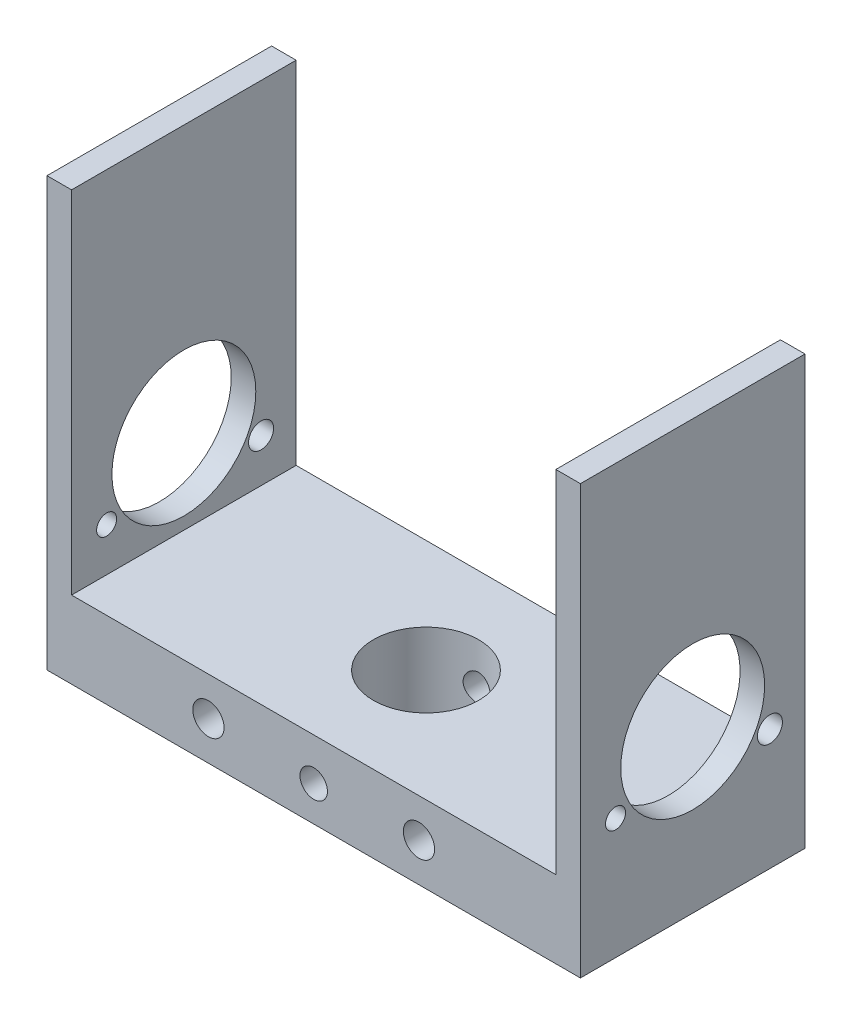
from build123d import *

# Parameters (mm, degrees)
BOSS_EXTRUDE1_DEPTH = 11
SKETCH2_W           = 3.5
SKETCH2_H           = 32
BOSS_EXTRUDE2_DEPTH = 50
SKETCH3_R           = 10.25
SKETCH3_R_2         = 1.783609491
SKETCH3_R_3         = 1.426196869
CUT_EXTRUDE1_DEPTH  = 50
SKETCH4_R           = 2.22645949
CUT_EXTRUDE2_DEPTH  = 36
SKETCH5_R           = 1.95657882
CUT_EXTRUDE3_DEPTH  = 32


with BuildPart() as part:
    # Sketch1 → Boss-Extrude1 (new body)
    with BuildSketch(Plane(origin=(0, 0, 0), x_dir=(1, 0, 0), z_dir=(0, 1, 0))):
        with BuildLine():
            Line((38, 16), (0, 16))
            Line((0, 16), (0, 7.5))
            ThreePointArc((0, 7.5), (5.303300859, 5.303300859), (7.5, 0))
            ThreePointArc((7.5, 0), (5.303300859, -5.303300859), (0, -7.5))
            Line((0, -7.5), (0, -16))
            Line((0, -16), (38, -16))
            Line((38, -16), (38, 16))
        make_face()
    boss_extrude1 = extrude(amount=BOSS_EXTRUDE1_DEPTH)

    # Sketch2 → Boss-Extrude2 (add)
    with BuildSketch(Plane(origin=(0, 11, 0), x_dir=(1, 0, 0), z_dir=(0, 1, 0))):
        with Locations((36.25, 0)):
            Rectangle(SKETCH2_W, SKETCH2_H)
    boss_extrude2 = extrude(amount=BOSS_EXTRUDE2_DEPTH)

    # Sketch3 → Cut-Extrude1 (cut)
    with BuildSketch(Plane.ZY.offset(-34.5)):
        with Locations((0, 23)):
            Circle(SKETCH3_R)
        with Locations((-11, 17.202811543)):
            Circle(SKETCH3_R_2)
        with Locations((11, 17.202811543)):
            Circle(SKETCH3_R_3)
    cut_extrude1 = extrude(amount=-CUT_EXTRUDE1_DEPTH, mode=Mode.SUBTRACT)

    # Sketch4 → Cut-Extrude2 (cut)
    with BuildSketch(Plane(origin=(0, 0, -16), x_dir=(-1, 0, 0), z_dir=(0, 0, -1))):
        with Locations((-15, 5.5)):
            Circle(SKETCH4_R)
    cut_extrude2 = extrude(amount=-CUT_EXTRUDE2_DEPTH, mode=Mode.SUBTRACT)

    # Mirror1: Boss-Extrude1, Boss-Extrude2, Cut-Extrude1, Cut-Extrude2 across plane
    add(boss_extrude1.mirror(Plane(origin=(0, 11, 0), x_dir=(0, 0, 1), z_dir=(1, 0, 0))))
    add(boss_extrude2.mirror(Plane(origin=(0, 11, 0), x_dir=(0, 0, 1), z_dir=(1, 0, 0))))
    add(cut_extrude1.mirror(Plane(origin=(0, 11, 0), x_dir=(0, 0, 1), z_dir=(1, 0, 0))), mode=Mode.SUBTRACT)
    add(cut_extrude2.mirror(Plane(origin=(0, 11, 0), x_dir=(0, 0, 1), z_dir=(1, 0, 0))), mode=Mode.SUBTRACT)

    # Sketch5 → Cut-Extrude3 (cut)
    with BuildSketch(Plane.XY.offset(16)):
        with Locations((0, 5)):
            Circle(SKETCH5_R)
    extrude(amount=-CUT_EXTRUDE3_DEPTH, mode=Mode.SUBTRACT)


solid = part.part
